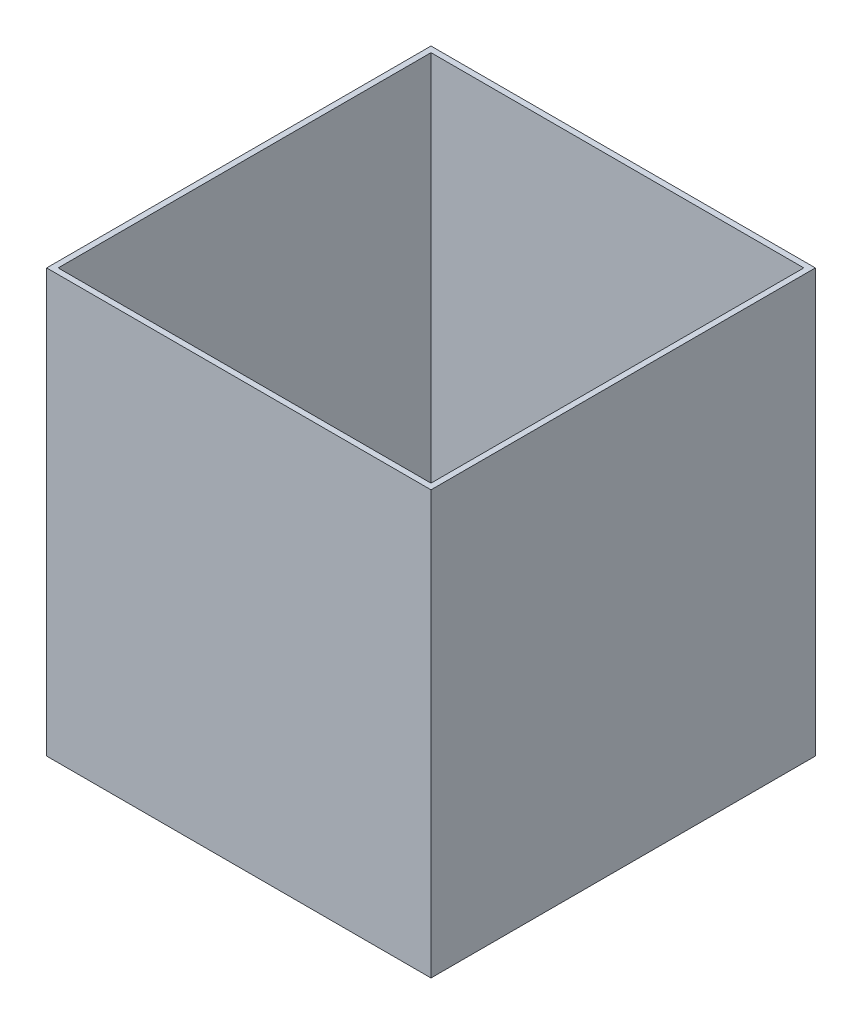
from build123d import *

# Parameters (mm, degrees)
SKETCH_1_W      = 200
SKETCH_1_H      = 200
SKETCH_1_W_2    = 194
SKETCH_1_H_2    = 194
EXTRUDE_1_DEPTH = 220


with BuildPart() as part:
    # 草图1 → 凸台-拉伸1 (new body)
    with BuildSketch(Plane(origin=(0, 0, 0), x_dir=(1, 0, 0), z_dir=(0, 1, 0))):
        with Locations((-100, 100)):
            Rectangle(SKETCH_1_W, SKETCH_1_H)
        with Locations((-100, 100)):
            Rectangle(SKETCH_1_W_2, SKETCH_1_H_2, mode=Mode.SUBTRACT)
    extrude(amount=EXTRUDE_1_DEPTH)


solid = part.part
